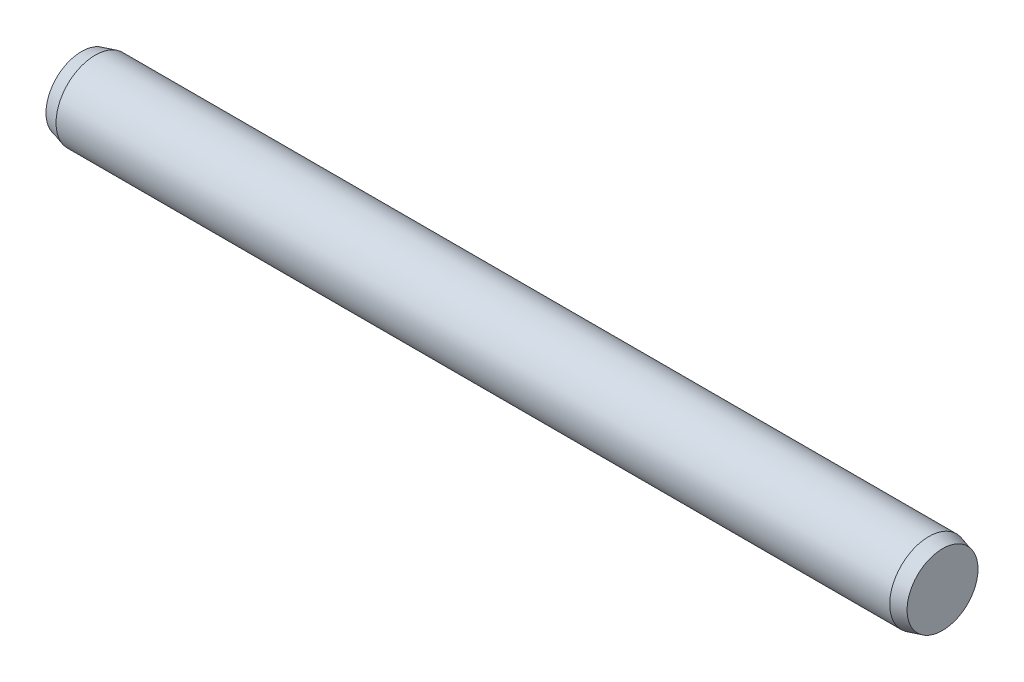
from build123d import *

# Parameters (mm, degrees)
EXTRUDE1_DEPTH      = 10.65
EXTRUDE1_DEPTH_BACK = 10.65
SKETCH2_R           = 1
SKETCH3_R           = 1
EXTRUDE2_DEPTH      = 0.35
EXTRUDE2_TAPER      = 15
SKETCH4_R           = 1
EXTRUDE3_DEPTH      = 0.35
EXTRUDE3_TAPER      = 15


with BuildPart() as part:
    # Sketch2 → Extrude1 (new, two sides: drawn at the far end of the back side and taken through both)
    with BuildSketch(Plane(origin=(0, 0, 0), x_dir=(0, 0, -1), z_dir=(1, 0, 0)).offset(-EXTRUDE1_DEPTH_BACK)):
        Circle(SKETCH2_R)
    extrude(amount=EXTRUDE1_DEPTH + EXTRUDE1_DEPTH_BACK)

    # Sketch3 → Extrude2 (add)
    with BuildSketch(Plane(origin=(10.65, 0, 0), x_dir=(0, 0, -1), z_dir=(1, 0, 0))):
        Circle(SKETCH3_R)
    extrude(amount=EXTRUDE2_DEPTH, taper=EXTRUDE2_TAPER)

    # Sketch4 → Extrude3 (add)
    with BuildSketch(Plane.ZY.offset(10.65)):
        with Locations(Location((0, 0, 0), (0, 0, 180))):
            Circle(SKETCH4_R)
    extrude(amount=EXTRUDE3_DEPTH, taper=EXTRUDE3_TAPER)


solid = part.part
